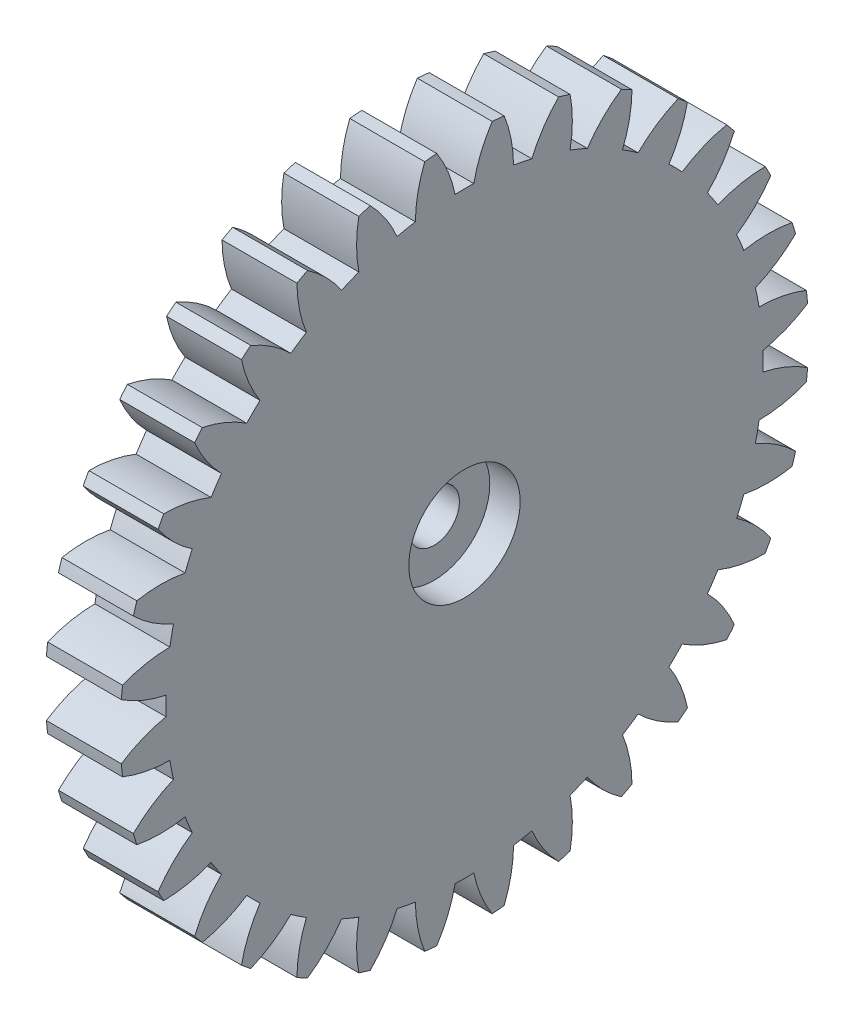
from build123d import *

# Parameters (mm, degrees)
BASPROSKE_W        = 3.7
BASPROSKE_H        = 17
TOOTHCUT_DEPTH     = 25.324678826
TEETHCUTS_COUNT    = 32
TEETHCUTS_ANGLE    = 348.75
BORSKE_R           = 1.25
BORE_DEPTH         = 50.0001016
SKETCH7_R          = 2.75
CUT_EXTRUDE7_DEPTH = 1.5


with BuildPart() as part:
    # BasProSke → Base-Revolve (revolve)
    with BuildSketch(Plane(origin=(0, 0, 0), x_dir=(1, 0, 0), z_dir=(0, 1, 0)), mode=Mode.PRIVATE) as base_revolve_sk:
        with Locations((1.85, 8.5)):
            Rectangle(BASPROSKE_W, BASPROSKE_H)
    revolve(base_revolve_sk.sketch.rotate(Axis((-10, 0, 0), (1, 0, 0)), 180), axis=Axis((-10, 0, 0), (1, 0, 0)))

    # TooCutSke → ToothCut (cut, through all)
    with BuildSketch(Plane(origin=(0, 0, 0), x_dir=(0, 0, -1), z_dir=(1, 0, 0))):
        with BuildLine():
            ThreePointArc((0.462036907, 14.741761187), (0, 14.749), (-0.462036907, 14.741761187))
            ThreePointArc((-0.462036907, 14.741761187), (-0.81854142, 15.899240468), (-1.386721275, 16.9688317))
            ThreePointArc((-1.386721275, 16.9688317), (0, 17.0254), (1.386721275, 16.9688317))
            ThreePointArc((1.386721275, 16.9688317), (0.81854142, 15.899240468), (0.462036907, 14.741761187))
        make_face()
    toothcut = extrude(amount=TOOTHCUT_DEPTH, mode=Mode.SUBTRACT)

    # TeethCuts: ToothCut ×32 about axis
    teethcuts_axis = Axis((-10, 0, 0), (1, 0, 0))
    for i in range(1, TEETHCUTS_COUNT):
        add(toothcut.rotate(teethcuts_axis, i * TEETHCUTS_ANGLE / (TEETHCUTS_COUNT - 1)), mode=Mode.SUBTRACT)

    # BorSke → Bore (cut, symmetric)
    with BuildSketch(Plane(origin=(0, 0, 0), x_dir=(0, 0, -1), z_dir=(1, 0, 0))):
        with Locations(Location((0, 0, 0), (0, 0, 180))):
            Circle(BORSKE_R)
    extrude(amount=BORE_DEPTH, both=True, mode=Mode.SUBTRACT)

    # Sketch7 → Cut-Extrude7 (cut)
    with BuildSketch(Plane(origin=(3.7, 0, 0), x_dir=(0, 0, -1), z_dir=(1, 0, 0))):
        Circle(SKETCH7_R)
    extrude(amount=-CUT_EXTRUDE7_DEPTH, mode=Mode.SUBTRACT)


solid = part.part
